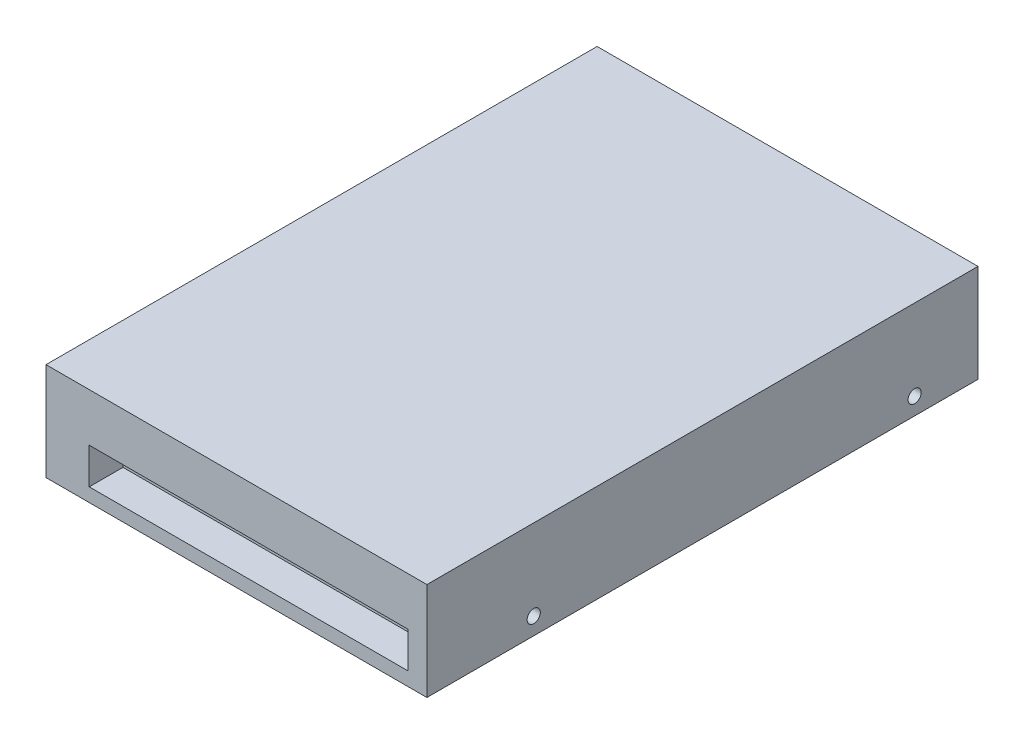
from build123d import *

# Parameters (mm, degrees)
SKICA1_W                 = 101.6
SKICA1_H                 = 147
P_IDAT_VYSUNUT_M1_DEPTH  = 26.1
SKICA3_W                 = 85.062789824
SKICA3_H                 = 9.622095786
ODEBRAT_VYSUNUT_M2_DEPTH = 9
SKICA2_R                 = 1.7526
ODEBRAT_VYSUNUT_M1_DEPTH = 5
SKICA4_R                 = 1.7526
ODEBRAT_VYSUNUT_M3_DEPTH = 5


with BuildPart() as part:
    # Skica1 → Přidat vysunutím1 (new body)
    with BuildSketch(Plane(origin=(0, 0, 0), x_dir=(1, 0, 0), z_dir=(0, 1, 0))):
        Rectangle(SKICA1_W, SKICA1_H)
    extrude(amount=P_IDAT_VYSUNUT_M1_DEPTH)

    # Skica3 → Odebrat vysunutím2 (cut)
    with BuildSketch(Plane.XY.offset(73.5)):
        with Locations((3.263182855, 8.448501867)):
            Rectangle(SKICA3_W, SKICA3_H)
    extrude(amount=-ODEBRAT_VYSUNUT_M2_DEPTH, mode=Mode.SUBTRACT)

    # Skica2 → Odebrat vysunutím1 (cut)
    with BuildSketch(Plane.XZ):
        with Locations(Location((-47.62, 32.22, 0), (0, 0, 270))):
            Circle(SKICA2_R)
        with Locations(Location((-47.62, -12.23, 0), (0, 0, 270))):
            Circle(SKICA2_R)
        with Locations(Location((-47.62, -43.98, 0), (0, 0, 270))):
            Circle(SKICA2_R)
    odebrat_vysunut_m1 = extrude(amount=-ODEBRAT_VYSUNUT_M1_DEPTH, mode=Mode.SUBTRACT)

    # Skica4 → Odebrat vysunutím3 (cut)
    with BuildSketch(Plane.ZY.offset(50.8)):
        with Locations((45, 4.567395648)):
            Circle(SKICA4_R)
        with Locations((-56.6, 4.567395648)):
            Circle(SKICA4_R)
    odebrat_vysunut_m3 = extrude(amount=-ODEBRAT_VYSUNUT_M3_DEPTH, mode=Mode.SUBTRACT)

    # Zrcadlit1: Odebrat vysunutím1, Odebrat vysunutím3 across plane
    add(odebrat_vysunut_m1.mirror(Plane(origin=(0, 0, 0), x_dir=(0, 0, 1), z_dir=(1, 0, 0))), mode=Mode.SUBTRACT)
    add(odebrat_vysunut_m3.mirror(Plane(origin=(0, 0, 0), x_dir=(0, 0, 1), z_dir=(1, 0, 0))), mode=Mode.SUBTRACT)


solid = part.part
